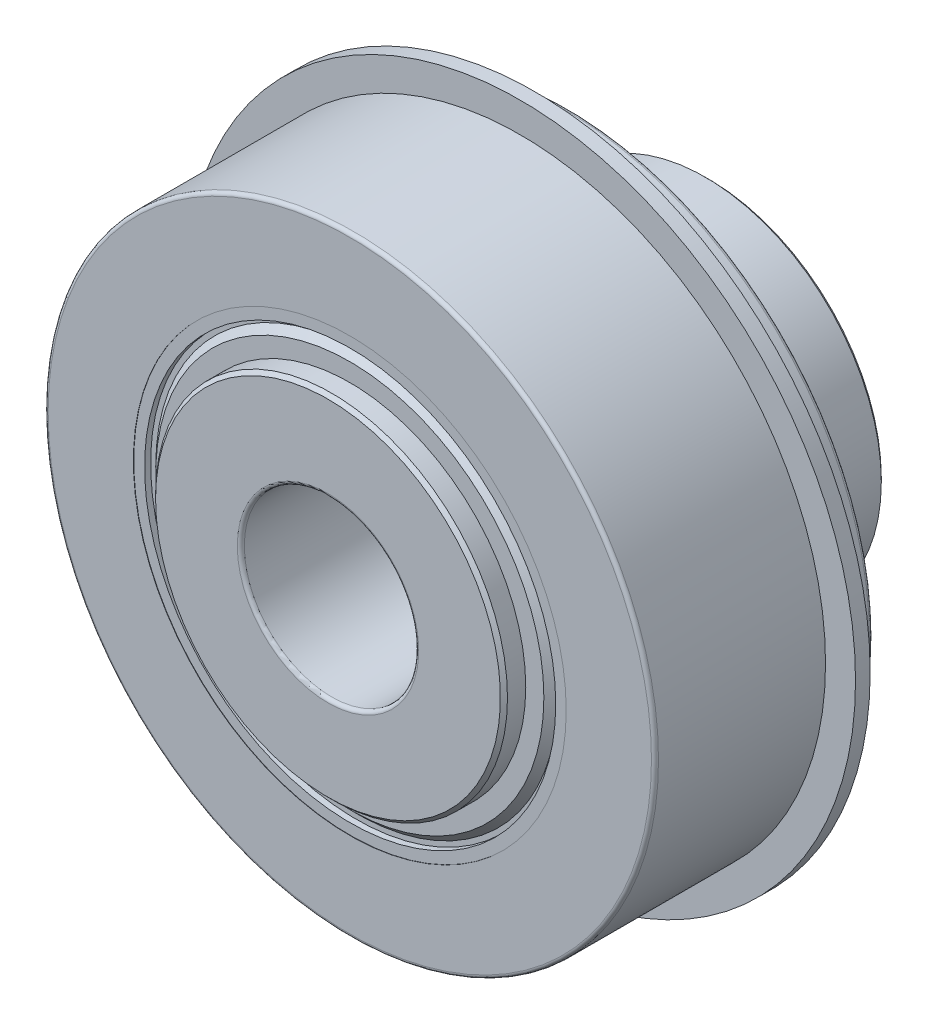
from build123d import *

# Parameters (mm, degrees)
SKETCH4_W          = 1.0668
SKETCH4_H          = 2.83083
SKETCH7_W          = 2.413
SKETCH7_H          = 12.8143
SKETCH8_W          = 2.413
SKETCH8_H          = 6.338292338
CUT_EXTRUDE1_DEPTH = 1.584573084
CHAMFER1_SIZE      = 0.2413
CIRPATTERN1_COUNT  = 2
CIRPATTERN1_ANGLE  = 120
CIRPATTERN2_COUNT  = 2
CIRPATTERN2_ANGLE  = 120
CHAMFER2_SIZE      = 0.256286
FILLET1_R          = 0.256286
FILLET2_R          = 0.256286


with BuildPart() as part:
    # Sketch1 → Revolve1 (revolve)
    with BuildSketch(Plane(origin=(0, 0, 0), x_dir=(0, 0, -1), z_dir=(1, 0, 0)), mode=Mode.PRIVATE) as revolve1_sk:
        with BuildLine():
            Line((-9.525, 12.8143), (-9.525, 6.35))
            Line((-9.525, 6.35), (18.2118, 6.35))
            Line((18.2118, 6.35), (18.2118, 12.8143))
            Line((18.2118, 12.8143), (3.685194476, 12.8143))
            ThreePointArc((3.685194476, 12.8143), (0, 10.31875), (-3.685194476, 12.8143))
            Line((-3.685194476, 12.8143), (-9.525, 12.8143))
        make_face()
    revolve(revolve1_sk.sketch.rotate(Axis((0, 0, 9.525), (0, 0, -1)), 90), axis=Axis((0, 0, 9.525), (0, 0, -1)))

    # Sketch7 → Cut-Revolve2 (revolve, cut)
    with BuildSketch(Plane(origin=(0, 0, 0), x_dir=(0, 0, -1), z_dir=(1, 0, 0)), mode=Mode.PRIVATE) as cut_revolve2_sk:
        with Locations((13.5001, 6.40715)):
            Rectangle(SKETCH7_W, SKETCH7_H)
    cut_revolve2 = revolve(cut_revolve2_sk.sketch.rotate(Axis((0, 12.8143, -12.2936), (0, -1, 0)), 180), axis=Axis((0, 12.8143, -12.2936), (0, -1, 0)), mode=Mode.SUBTRACT)

    # CirPattern1: Cut-Revolve2 ×2 about axis
    cirpattern1_axis = Axis((0, 0, -9.525), (0, 0, -1))
    for i in range(1, CIRPATTERN1_COUNT):
        add(cut_revolve2.rotate(cirpattern1_axis, i * CIRPATTERN1_ANGLE / (CIRPATTERN1_COUNT - 1)), mode=Mode.SUBTRACT)

    # Chamfer2
    chamfer2_edges = [part.edges().sort_by_distance(p)[0] for p in [
        (-12.8143, 0, -18.2118),
        (-12.8143, 0, 9.525),
    ]]
    chamfer(chamfer2_edges, length=CHAMFER2_SIZE)

    # Fillet1
    fillet1_edges = [part.edges().sort_by_distance(p)[0] for p in [
        (-6.35, 0, -18.2118),
        (-6.35, 0, 9.525),
    ]]
    fillet(fillet1_edges, radius=FILLET1_R)


with BuildPart() as body_2:
    # Sketch3 → Revolve2 (revolve)
    with BuildSketch(Plane(origin=(0, 0, 0), x_dir=(0, 0, -1), z_dir=(1, 0, 0)), mode=Mode.PRIVATE) as revolve2_sk:
        with BuildLine():
            Line((-3.685194476, 15.7607), (-7.9375, 15.7607))
            Line((-7.9375, 15.7607), (-7.9375, 22.225))
            Line((-7.9375, 22.225), (4.4831, 22.225))
            Line((4.4831, 22.225), (4.4831, 21.57857))
            Line((4.4831, 21.57857), (5.5499, 21.57857))
            Line((5.5499, 21.57857), (5.5499, 22.225))
            Line((5.5499, 22.225), (7.9375, 22.225))
            Line((7.9375, 22.225), (7.9375, 15.7607))
            Line((7.9375, 15.7607), (3.685194476, 15.7607))
            ThreePointArc((3.685194476, 15.7607), (0, 18.25625), (-3.685194476, 15.7607))
        make_face()
    revolve(revolve2_sk.sketch.rotate(Axis((0, 0, 9.525), (0, 0, -1)), 90), axis=Axis((0, 0, 9.525), (0, 0, -1)))

    # Fillet2
    fillet2_edges = [body_2.edges().sort_by_distance(p)[0] for p in [
        (-22.225, 0, 7.9375),
        (-22.225, 0, -7.9375),
    ]]
    fillet(fillet2_edges, radius=FILLET2_R)


with BuildPart() as body_3:
    # Sketch4 → Revolve3 (revolve)
    with BuildSketch(Plane(origin=(0, 0, 0), x_dir=(0, 0, -1), z_dir=(1, 0, 0)), mode=Mode.PRIVATE) as revolve3_sk:
        with Locations((5.0165, 22.993985)):
            Rectangle(SKETCH4_W, SKETCH4_H)
    revolve(revolve3_sk.sketch.rotate(Axis((0, 0, 9.525), (0, 0, -1)), 90), axis=Axis((0, 0, 9.525), (0, 0, -1)))


with BuildPart() as body_4:
    # Sketch5 → Revolve4 (revolve)
    with BuildSketch(Plane(origin=(0, 0, 0), x_dir=(0, 0, -1), z_dir=(1, 0, 0)), mode=Mode.PRIVATE) as revolve4_sk:
        Polygon((-7.9375, 14.132985168), (-7.9375, 12.8143), (-7.496674388, 12.8143), (-7.496674388, 13.95038922), (-7.005048776, 14.442014832), (-7.005048776, 15.7607), (-7.9121, 15.7607), (-7.9121, 14.972242584), (-7.471274388, 14.972242584), (-7.471274388, 15.319874388), (-7.445874388, 15.319874388), (-7.445874388, 14.62461078), align=None)
        Polygon((7.9375, 12.8143), (7.496674388, 12.8143), (7.496674388, 13.95038922), (7.005048776, 14.442014832), (7.005048776, 15.7607), (7.9121, 15.7607), (7.9121, 14.972242584), (7.471274388, 14.972242584), (7.471274388, 15.319874388), (7.445874388, 15.319874388), (7.445874388, 14.62461078), (7.9375, 14.132985168), align=None)
    revolve(revolve4_sk.sketch.rotate(Axis((0, 0, 9.525), (0, 0, -1)), 90), axis=Axis((0, 0, 9.525), (0, 0, -1)))


with BuildPart() as body_5:
    # Sketch8 → Revolve5 (revolve)
    with BuildSketch(Plane(origin=(0, 0, 0), x_dir=(0, 0, -1), z_dir=(1, 0, 0)), mode=Mode.PRIVATE) as revolve5_sk:
        with Locations((13.5001, 10.153153831)):
            Rectangle(SKETCH8_W, SKETCH8_H)
    revolve(revolve5_sk.sketch.rotate(Axis((0, 12.8143, -12.2936), (0, -1, 0)), 180), axis=Axis((0, 12.8143, -12.2936), (0, -1, 0)))

    # Sketch9 → Cut-Extrude1 (cut)
    with BuildSketch(Plane(origin=(0, 13.3223, 0), x_dir=(-1, 0, 0), z_dir=(0, 1, 0))):
        Polygon((0, -13.6867462), (1.2065, -12.9901731), (1.2065, -11.5970269), (0, -10.9004538), (-1.2065, -11.5970269), (-1.2065, -12.9901731), align=None)
    extrude(amount=-CUT_EXTRUDE1_DEPTH, mode=Mode.SUBTRACT)

    # Chamfer1
    chamfer1_edges = [body_5.edges().sort_by_distance(p)[0] for p in [
        (0, 13.3223, -14.7066),
    ]]
    chamfer(chamfer1_edges, length=CHAMFER1_SIZE)


with BuildPart() as cirpattern2_1:
    # CirPattern2: pattern copy
    add(body_5.part.rotate(Axis((0, 0, 0), (0, 0, -1)), 1 * CIRPATTERN2_ANGLE / (CIRPATTERN2_COUNT - 1)))


solid = Compound([part.part, body_2.part, body_3.part, body_4.part, body_5.part, cirpattern2_1.part])
